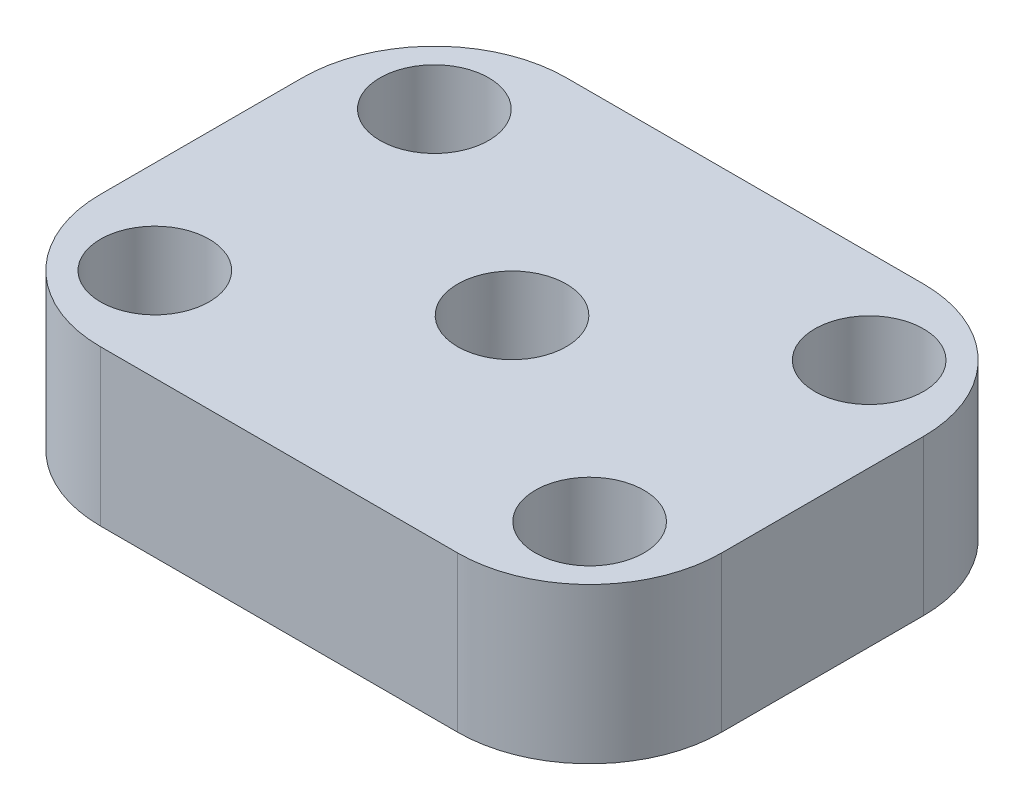
from build123d import *

# Parameters (mm, degrees)
SKETCH1_W             = 40
SKETCH1_H             = 30
BOSS_EXTRUDE1_DEPTH   = 10
SKETCH3_R             = 6.625
CUT_EXTRUDE1_DEPTH    = 4.5
SKETCH4_R             = 3.5
CUT_EXTRUDE2_DEPTH    = 27.925824036
F_3_0MM_DOWEL_HOLE1_D = 3
FILLET1_R             = 8.5
SKETCH9_R             = 3.5
CUT_EXTRUDE3_DEPTH    = 5


with BuildPart() as part:
    # Sketch1 → Boss-Extrude1 (new body)
    with BuildSketch(Plane(origin=(0, 0, 0), x_dir=(1, 0, 0), z_dir=(0, 1, 0))):
        Rectangle(SKETCH1_W, SKETCH1_H)
    extrude(amount=BOSS_EXTRUDE1_DEPTH)

    # Sketch3 → Cut-Extrude1 (cut)
    with BuildSketch(Plane.XZ):
        with Locations(Location((0, 0, 0), (0, 0, 270))):
            Circle(SKETCH3_R)
    extrude(amount=-CUT_EXTRUDE1_DEPTH, mode=Mode.SUBTRACT)

    # Sketch4 → Cut-Extrude2 (cut, through all)
    with BuildSketch(Plane(origin=(0, 10, 0), x_dir=(1, 0, 0), z_dir=(0, 1, 0))):
        with Locations(Location((0, 0, 0), (0, 0, 270))):
            Circle(SKETCH4_R)
    extrude(amount=-CUT_EXTRUDE2_DEPTH, mode=Mode.SUBTRACT)

    # Ø3.0mm Dowel Hole1 (through all)
    with Locations(Plane(origin=(0, 10, 0), x_dir=(1, 0, 0), z_dir=(0, 1, 0))):
        with Locations((-14, 9), (-14, -9), (14, -9), (14, 9)):
            Hole(F_3_0MM_DOWEL_HOLE1_D / 2)

    # Fillet1
    fillet1_edges = [part.edges().sort_by_distance(p)[0] for p in [
        (20, 5, 15),
        (-20, 5, 15),
        (-20, 5, -15),
        (20, 5, -15),
    ]]
    fillet(fillet1_edges, radius=FILLET1_R)

    # Sketch9 → Cut-Extrude3 (cut)
    with BuildSketch(Plane(origin=(0, 10, 0), x_dir=(1, 0, 0), z_dir=(0, 1, 0))):
        with Locations(Location((14, -9, 0), (0, 0, 270))):
            Circle(SKETCH9_R)
        with Locations(Location((-14, -9, 0), (0, 0, 270))):
            Circle(SKETCH9_R)
        with Locations(Location((-14, 9, 0), (0, 0, 270))):
            Circle(SKETCH9_R)
        with Locations(Location((14, 9, 0), (0, 0, 270))):
            Circle(SKETCH9_R)
    extrude(amount=-CUT_EXTRUDE3_DEPTH, mode=Mode.SUBTRACT)


solid = part.part
